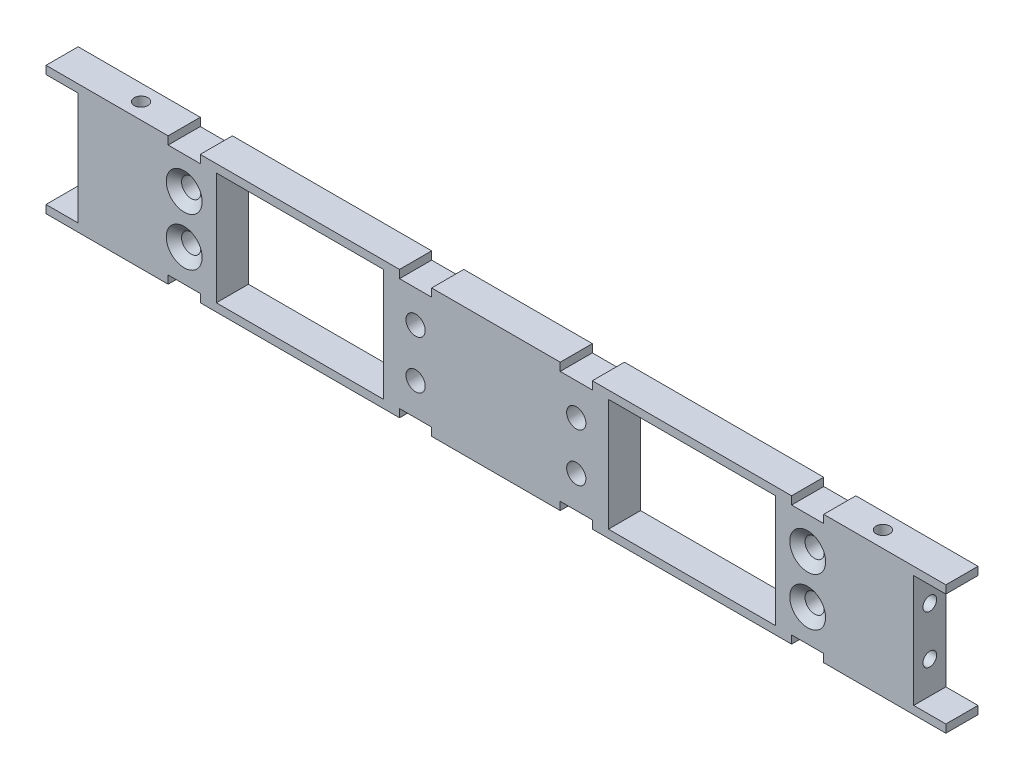
from build123d import *

# Parameters (mm, degrees)
BOSS_EXTRUDE1_DEPTH                               = 6.35
TAP_DRILL_FOR_6_32_TAP1_AT_2_COUNT                = 2
TAP_DRILL_FOR_6_32_TAP1_AT_2_PITCH                = 9.525
SKETCH7_W                                         = 6.35
SKETCH7_H                                         = 1.5875
CUT_EXTRUDE1_DEPTH                                = 91.02678768
SKETCH10_W                                        = 6.35
SKETCH10_H                                        = 1.5875
SKETCH10_W_2                                      = 33.02
SKETCH10_H_2                                      = 22.225
CUT_EXTRUDE5_DEPTH                                = 91.02678768
CSK_FOR_6_FLAT_HEAD_MACHINE_SCREW_100_D           = 3.7973
CSK_FOR_6_FLAT_HEAD_MACHINE_SCREW_100_CSINK_D     = 7.0866
CSK_FOR_6_FLAT_HEAD_MACHINE_SCREW_100_CSINK_ANGLE = 100
CSK_FOR_6_FLAT_HEAD_MACHINE_SCREW_2_D             = 3.7973
CSK_FOR_6_FLAT_HEAD_MACHINE_SCREW_2_CSINK_D       = 7.0866
CSK_FOR_6_FLAT_HEAD_MACHINE_SCREW_2_CSINK_ANGLE   = 100


with BuildPart() as part:
    # Sketch1 → Boss-Extrude1 (new body)
    with BuildSketch(Plane.XY):
        Polygon((-88.9, 12.7), (88.9, 12.7), (88.9, 11.1125), (82.55, 11.1125), (82.55, -11.1125), (88.9, -11.1125), (88.9, -12.7), (-88.9, -12.7), (-88.9, -11.1125), (-82.55, -11.1125), (-82.55, 11.1125), (-88.9, 11.1125), align=None)
    extrude(amount=BOSS_EXTRUDE1_DEPTH)

    # Sketch4 → Tap Drill for #6-32 Tap1 (revolve, cut)
    with BuildSketch(Plane(origin=(-82.55, 4.7625, 3.175), x_dir=(0, 0, 1), z_dir=(0, 1, 0))):
        Polygon((0, 0), (0, 13.51269403), (1.35255, 12.7), (1.35255, 0), align=None)
    tap_drill_for_6_32_tap1 = revolve(axis=Axis((-88.9, 4.7625, 3.175), (1, 0, 0)), mode=Mode.SUBTRACT)

    # Tap Drill for #6-32 Tap1 at 2: Tap Drill for #6-32 Tap1 ×2
    with Locations(*[(0, -i * TAP_DRILL_FOR_6_32_TAP1_AT_2_PITCH, 0) for i in range(1, TAP_DRILL_FOR_6_32_TAP1_AT_2_COUNT)]):
        add(tap_drill_for_6_32_tap1, mode=Mode.SUBTRACT)

    # Mirror1: Tap Drill for #6-32 Tap1 across plane
    add(tap_drill_for_6_32_tap1.mirror(Plane(origin=(0, 0, 0), x_dir=(0, 0, 1), z_dir=(1, 0, 0))), mode=Mode.SUBTRACT)

    # Mirror1 copy 1 sketch → Mirror1 copy 1 (revolve, cut)
    with BuildSketch(Plane(origin=(82.55, -4.7625, 3.175), x_dir=(0, 0, 1), z_dir=(0, 1, 0))):
        Polygon((0, 0), (0, -13.51269403), (1.35255, -12.7), (1.35255, 0), align=None)
    revolve(axis=Axis((88.9, -4.7625, 3.175), (1, 0, 0)), mode=Mode.SUBTRACT)

    # Sketch5 → Tap Drill for #6-32 Tap2 (revolve, cut)
    with BuildSketch(Plane(origin=(-73.289583418, 12.7, 3.175), x_dir=(0, 0, 1), z_dir=(1, 0, 0))):
        Polygon((0, 0), (0, 7.16269403), (1.35255, 6.35), (1.35255, 0), align=None)
    tap_drill_for_6_32_tap2 = revolve(axis=Axis((-73.289583418, 19.05, 3.175), (0, -1, 0)), mode=Mode.SUBTRACT)

    # Mirror2: Tap Drill for #6-32 Tap2 across plane
    add(tap_drill_for_6_32_tap2.mirror(Plane(origin=(0, 0, 0), x_dir=(0, 0, 1), z_dir=(1, 0, 0))), mode=Mode.SUBTRACT)

    # Mirror3: Tap Drill for #6-32 Tap2 across plane
    add(tap_drill_for_6_32_tap2.mirror(Plane(origin=(0, 0, 0), x_dir=(0, 0, 1), z_dir=(0, -1, 0))), mode=Mode.SUBTRACT)

    # Mirror3 copy 1 sketch → Mirror3 copy 1 (revolve, cut)
    with BuildSketch(Plane(origin=(73.289583418, -12.7, 3.175), x_dir=(0, 0, 1), z_dir=(-1, 0, 0))):
        Polygon((0, 0), (0, 7.16269403), (1.35255, 6.35), (1.35255, 0), align=None)
    revolve(axis=Axis((73.289583418, -19.05, 3.175), (0, 1, 0)), mode=Mode.SUBTRACT)

    # Sketch7 → Cut-Extrude1 (cut, through all)
    with BuildSketch(Plane.XY.offset(6.35)):
        with Locations((-61.595, 11.90625)):
            Rectangle(SKETCH7_W, SKETCH7_H)
        with Locations((-61.595, -11.90625)):
            Rectangle(SKETCH7_W, SKETCH7_H)
        with Locations((61.595, -11.90625)):
            Rectangle(SKETCH7_W, SKETCH7_H)
        with Locations((61.595, 11.90625)):
            Rectangle(SKETCH7_W, SKETCH7_H)
    extrude(amount=-CUT_EXTRUDE1_DEPTH, mode=Mode.SUBTRACT)

    # Sketch10 → Cut-Extrude5 (cut, through all)
    with BuildSketch(Plane(origin=(0, 0, 0), x_dir=(-1, 0, 0), z_dir=(0, 0, -1))):
        with Locations((-15.875, 11.90625)):
            Rectangle(SKETCH10_W, SKETCH10_H)
        with Locations((15.875, 11.90625)):
            Rectangle(SKETCH10_W, SKETCH10_H)
        with Locations((-15.875, -11.90625)):
            Rectangle(SKETCH10_W, SKETCH10_H)
        with Locations((15.875, -11.90625)):
            Rectangle(SKETCH10_W, SKETCH10_H)
        with Locations((-38.735, 0)):
            Rectangle(SKETCH10_W_2, SKETCH10_H_2)
        with Locations((38.735, 0)):
            Rectangle(SKETCH10_W_2, SKETCH10_H_2)
    extrude(amount=-CUT_EXTRUDE5_DEPTH, mode=Mode.SUBTRACT)

    # CSK for _6 Flat Head Machine Screw _100 (through all)
    with Locations(Plane.XY.offset(6.35)):
        with Locations((-61.595, 4.7625), (-61.595, -4.7625)):
            csk_for_6_flat_head_machine_screw_100 = CounterSinkHole(CSK_FOR_6_FLAT_HEAD_MACHINE_SCREW_100_D / 2, CSK_FOR_6_FLAT_HEAD_MACHINE_SCREW_100_CSINK_D / 2, counter_sink_angle=CSK_FOR_6_FLAT_HEAD_MACHINE_SCREW_100_CSINK_ANGLE)

    # CSK for _6 Flat Head Machine Screw _ 2 (through all)
    with Locations(Plane(origin=(0, 0, 0), x_dir=(-1, 0, 0), z_dir=(0, 0, -1))):
        with Locations((15.875, 4.7625), (15.875, -4.7625)):
            csk_for_6_flat_head_machine_screw_2 = CounterSinkHole(CSK_FOR_6_FLAT_HEAD_MACHINE_SCREW_2_D / 2, CSK_FOR_6_FLAT_HEAD_MACHINE_SCREW_2_CSINK_D / 2, counter_sink_angle=CSK_FOR_6_FLAT_HEAD_MACHINE_SCREW_2_CSINK_ANGLE)

    # Mirror5: CSK for _6 Flat Head Machine Screw _100, CSK for _6 Flat Head Machine Screw _ 2 across plane
    add(csk_for_6_flat_head_machine_screw_100.mirror(Plane(origin=(0, 0, 0), x_dir=(0, 0, 1), z_dir=(1, 0, 0))), mode=Mode.SUBTRACT)
    add(csk_for_6_flat_head_machine_screw_2.mirror(Plane(origin=(0, 0, 0), x_dir=(0, 0, 1), z_dir=(1, 0, 0))), mode=Mode.SUBTRACT)


solid = part.part
